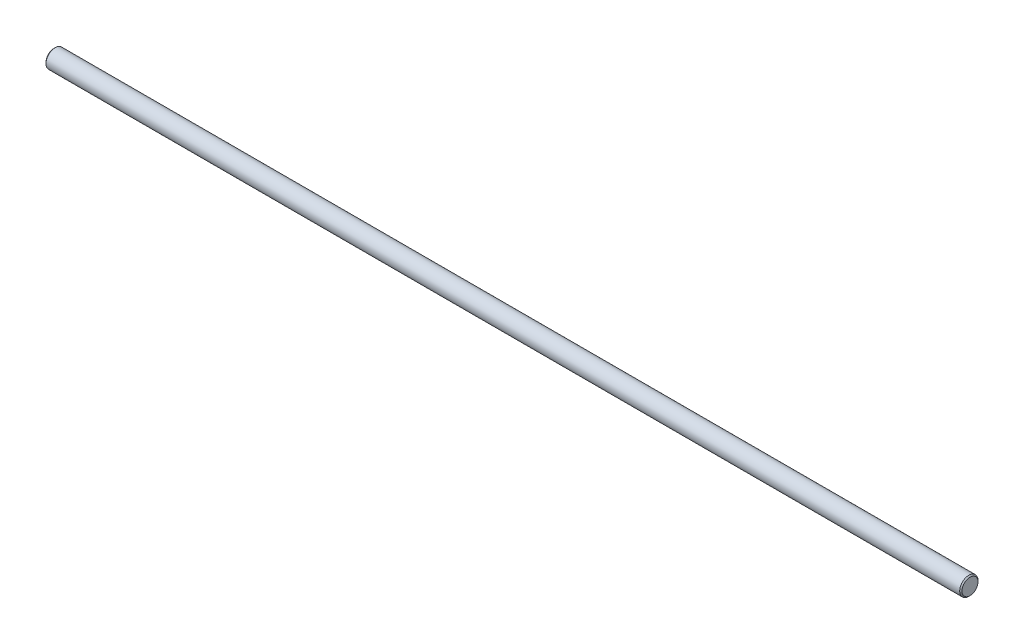
from build123d import *

# Parameters (mm, degrees)
SKETCH1_R      = 4
EXTRUDE1_DEPTH = 400
CHAMFER1_SIZE  = 0.5


with BuildPart() as part:
    # Sketch1 → Extrude1 (new body)
    with BuildSketch(Plane(origin=(0, 0, 0), x_dir=(0, 0, -1), z_dir=(1, 0, 0))):
        Circle(SKETCH1_R)
    extrude(amount=EXTRUDE1_DEPTH)

    # Chamfer1
    chamfer1_edges = [part.edges().sort_by_distance(p)[0] for p in [
        (0, 0, 4),
        (400, 0, 4),
    ]]
    chamfer(chamfer1_edges, length=CHAMFER1_SIZE)


solid = part.part
